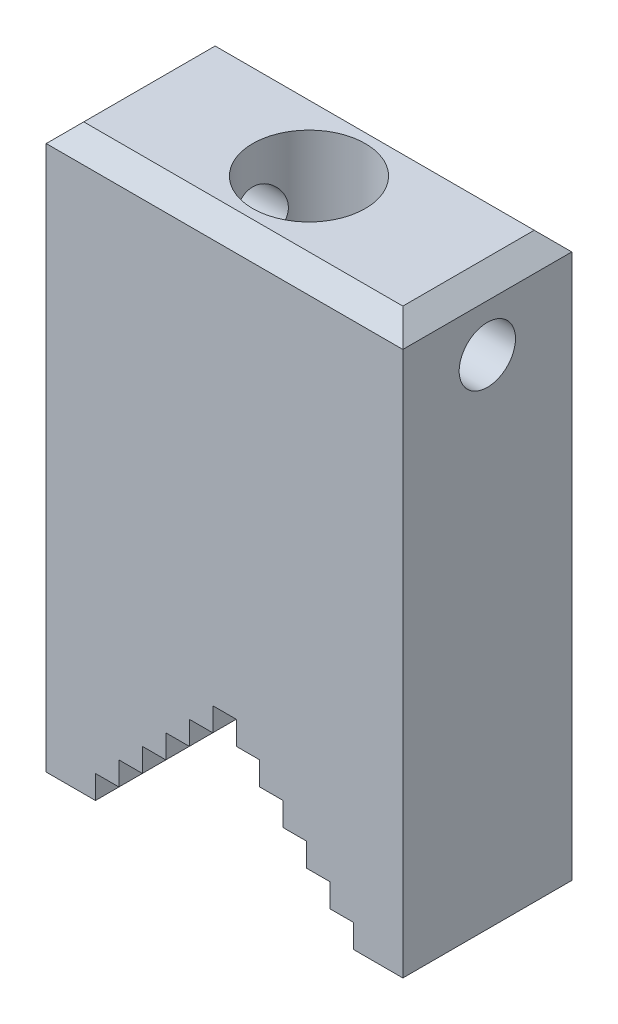
from build123d import *

# Parameters (mm, degrees)
SKETCH1_W                   = 18
SKETCH1_H                   = 60
SKETCH1_R                   = 3
BOSS_EXTRUDE1_DEPTH         = 38
CHAMFER1_SIZE               = 2
CUT_EXTRUDE1_DEPTH          = 38
M12X1_25_TAPPED_HOLE1_D     = 12
M12X1_25_TAPPED_HOLE1_DEPTH = 20
M12X1_25_TAPPED_HOLE1_TIP   = 3.464101615


with BuildPart() as part:
    # Sketch1 → Boss-Extrude1 (new body)
    with BuildSketch(Plane(origin=(0, 0, 0), x_dir=(0, 0, -1), z_dir=(1, 0, 0))):
        Rectangle(SKETCH1_W, SKETCH1_H)
        with Locations((0, 23)):
            Circle(SKETCH1_R, mode=Mode.SUBTRACT)
    extrude(amount=-BOSS_EXTRUDE1_DEPTH)

    # Chamfer1
    chamfer1_edges = [part.edges().sort_by_distance(p)[0] for p in [
        (-38, 30, 0),
        (0, 30, 0),
        (-19, 30, 9),
        (-19, 30, -9),
    ]]
    chamfer(chamfer1_edges, length=CHAMFER1_SIZE)

    # Sketch2 → Cut-Extrude1 (cut)
    with BuildSketch(Plane.XY.offset(9)):
        Polygon((-32.75, -30), (-32.75, -27.5), (-30.25, -27.5), (-30.25, -25), (-27.75, -25), (-27.75, -22.5), (-25.25, -22.5), (-25.25, -20), (-22.75, -20), (-22.75, -17.5), (-20.25, -17.5), (-20.25, -15), (-17.75, -15), (-17.75, -17.5), (-15.25, -17.5), (-15.25, -20), (-12.75, -20), (-12.75, -22.5), (-10.25, -22.5), (-10.25, -25), (-7.75, -25), (-7.75, -27.5), (-5.25, -27.5), (-5.25, -30), align=None)
    extrude(amount=-CUT_EXTRUDE1_DEPTH, mode=Mode.SUBTRACT)

    # M12x1.25 Tapped Hole1
    with Locations(Plane(origin=(0, 30, 0), x_dir=(1, 0, 0), z_dir=(0, 1, 0))):
        with Locations((-19, 0)):
            Hole(M12X1_25_TAPPED_HOLE1_D / 2, depth=M12X1_25_TAPPED_HOLE1_DEPTH)
            with Locations((0, 0, -(M12X1_25_TAPPED_HOLE1_DEPTH + M12X1_25_TAPPED_HOLE1_TIP / 2))):  # 120° drill point
                Cone(0, M12X1_25_TAPPED_HOLE1_D / 2, M12X1_25_TAPPED_HOLE1_TIP, mode=Mode.SUBTRACT)


solid = part.part
